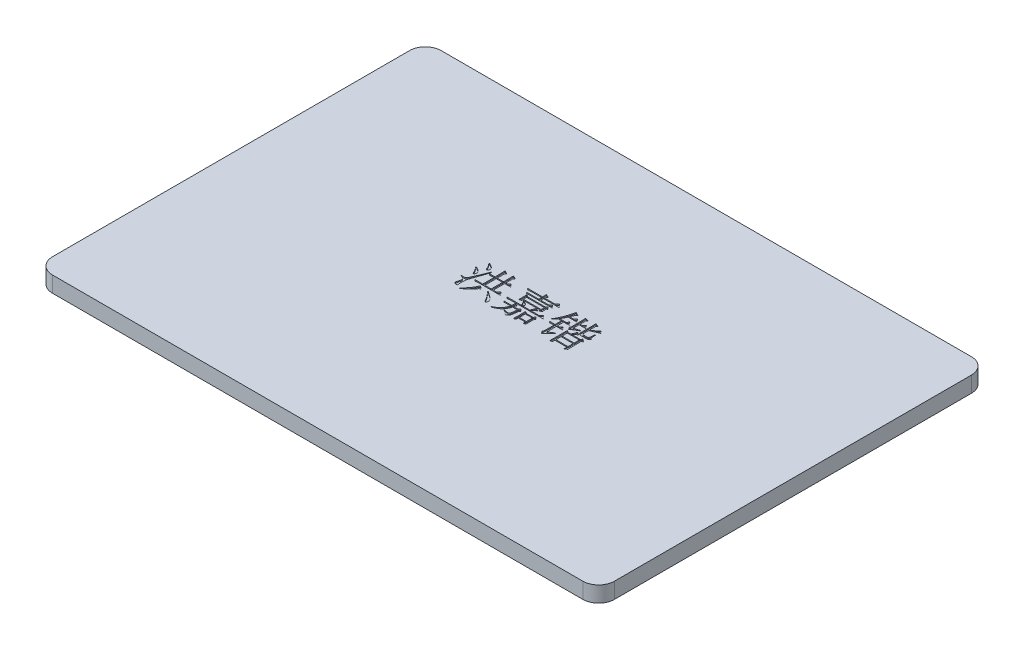
from build123d import *

# Parameters (mm, degrees)
SKETCH_1_W          = 355.22472
SKETCH_1_H          = 245.700000174
EXTRUDE_1_DEPTH     = 10
FILLET_1_R          = 10
SKETCH_5_W          = 4.018359375
SKETCH_5_H          = 7.19717548
SKETCH_5_W_2        = 11.230799279
SKETCH_5_H_2        = 2.068329327
SKETCH_5_W_3        = 4.430498799
SKETCH_5_H_3        = 3.777944711
SKETCH_5_W_4        = 7.624579327
SKETCH_5_H_4        = 3.289483173
CUT_EXTRUDE_2_DEPTH = 0.7


with BuildPart() as part:
    # 草图1 → 凸台-拉伸1 (new body)
    with BuildSketch(Plane(origin=(0, 0, 0), x_dir=(1, 0, 0), z_dir=(0, 1, 0))):
        Rectangle(SKETCH_1_W, SKETCH_1_H)
    extrude(amount=EXTRUDE_1_DEPTH)

    # 圆角1
    fillet_1_edges = [part.edges().sort_by_distance(p)[0] for p in [
        (-177.61236, 5, 122.850000087),
        (-177.61236, 5, -122.850000087),
        (177.61236, 5, -122.850000087),
        (177.61236, 5, 122.850000087),
    ]]
    fillet(fillet_1_edges, radius=FILLET_1_R)

    # 草图5 → 切除-拉伸2 (cut)
    # profile 1 of 15: a face of its own
    with BuildSketch(Plane(origin=(0, 10, 0), x_dir=(1, 0, 0), z_dir=(0, 1, 0))):
        with BuildLine():
            Line((-26.376532916, 6.455864329), (-24.315835801, 4.910341492))
            Line((-24.315835801, 4.910341492), (-25.243149503, 4.498202069))
            add(Edge.make_bspline(
                [(-25.243149503, 4.498202069), (-25.552872326, 4.127666283), (-26.149794207, 3.413540935), (-27.044370975, 2.406984084), (-27.899638569, 1.503294035), (-28.716982063, 0.702583654), (-29.494290751, 0.004558656), (-30.236503903, -0.587768107), (-30.933681629, -1.089794593), (-31.407491806, -1.353330367), (-31.63131056, -1.477819566)],
                knots=[0, 0, 0, 0, 1.317503974, 2.539195995, 3.673307354, 4.711404462, 5.660169823, 6.521932252, 7.301789409, 8, 8, 8, 8], degree=3))
            Line((-31.63131056, -1.477819566), (-31.837380272, -1.168714998))
            add(Edge.make_bspline(
                [(-31.837380272, -1.168714998), (-31.527875157, -0.868874119), (-30.918337529, -0.278369182), (-30.067008552, 0.645493035), (-29.279219378, 1.577579332), (-28.564829928, 2.527366724), (-27.913300318, 3.486491027), (-27.328794133, 4.458550814), (-26.81279952, 5.445977662), (-26.521318333, 6.120709494), (-26.376532916, 6.455864329)],
                knots=[0, 0, 0, 0, 1.094406095, 2.155317194, 3.189574899, 4.19315574, 5.17266735, 6.133525116, 7.072878954, 8, 8, 8, 8], degree=3))
        make_face()
    # profile 2 of 15: a face of its own
    with BuildSketch(Plane(origin=(0, 10, 0), x_dir=(1, 0, 0), z_dir=(0, 1, 0))):
        with BuildLine():
            add(Edge.make_bspline(
                [(-20.812650705, 5.807126348), (-20.60478678, 5.674361816), (-20.199788776, 5.415686001), (-19.618211143, 5.02542716), (-19.072922315, 4.656508634), (-18.566737052, 4.306195178), (-18.105508085, 3.966775152), (-17.686182121, 3.641307221), (-17.302803307, 3.336761719), (-16.959294386, 3.046554697), (-16.650408498, 2.771315947), (-16.379238674, 2.50264444), (-16.138169095, 2.24656537), (-15.936190004, 1.995611048), (-15.760370394, 1.761337327), (-15.627056736, 1.529297251), (-15.521444514, 1.309505004), (-15.433603066, 1.035860457), (-15.376461385, 0.715649962), (-15.375459752, 0.35602173), (-15.451956754, 0.030371522), (-15.599828125, -0.239305416), (-15.761029304, -0.459655331), (-15.916857552, -0.613343493), (-16.042524039, -0.732070349), (-16.136551052, -0.749322408), (-16.176082195, -0.756575575)],
                knots=[0, 0, 0, 0, 1.886732976, 3.676073606, 5.357514201, 6.92318489, 8.384823373, 9.737552754, 10.983710712, 12.129971186, 13.177293715, 14.147504746, 15.049540137, 15.865657004, 16.611132248, 17.287059304, 17.909606159, 18.472736264, 19.480620271, 20.385642455, 21.206963833, 22.007796368, 22.723990221, 23.28137395, 23.697872896, 24, 24, 24, 24], degree=3))
            add(Edge.make_bspline(
                [(-16.176082195, -0.756575575), (-16.212536716, -0.751313744), (-16.29527836, -0.739370846), (-16.414440035, -0.656438112), (-16.538857214, -0.531215914), (-16.675426538, -0.361072944), (-16.825791219, -0.145949737), (-16.978725852, 0.12151421), (-17.142582862, 0.435414974), (-17.251615587, 0.661408545), (-17.309465608, 0.78131505)],
                knots=[0, 0, 0, 0, 0.445326263, 1.010767021, 1.725627242, 2.60973878, 3.671005391, 4.932592747, 6.372510858, 8, 8, 8, 8], degree=3))
            add(Edge.make_bspline(
                [(-17.309465608, 0.78131505), (-17.40137521, 0.956845991), (-17.591893265, 1.320701485), (-17.932138284, 1.860356971), (-18.31734791, 2.42310745), (-18.758275932, 3.001446873), (-19.246958991, 3.602048575), (-19.790427887, 4.21831707), (-20.381560484, 4.857641701), (-20.802359985, 5.280567884), (-21.018720416, 5.498021781)],
                knots=[0, 0, 0, 0, 0.789049163, 1.63560835, 2.539413484, 3.50528574, 4.531787278, 5.623452301, 6.778062039, 8, 8, 8, 8], degree=3))
            Line((-21.018720416, 5.498021781), (-20.812650705, 5.807126348))
        make_face()
    # profile 3 of 15: a face of its own
    with BuildSketch(Plane(origin=(0, 10, 0), x_dir=(1, 0, 0), z_dir=(0, 1, 0))):
        with BuildLine():
            add(Edge.make_bspline(
                [(-26.685637483, 15.992312646), (-26.684847779, 16.38537431), (-26.683339912, 17.135889454), (-26.693526747, 18.208198554), (-26.69965064, 19.174966297), (-26.710344061, 20.036172988), (-26.727441741, 20.791697538), (-26.73909538, 21.44064099), (-26.763369532, 21.98371943), (-26.78084884, 22.310522999), (-26.788672339, 22.456795819)],
                knots=[0, 0, 0, 0, 1.458918773, 2.785671391, 3.980227968, 5.04736289, 5.98239479, 6.78525834, 7.4562982, 8, 8, 8, 8], degree=3))
            Line((-26.788672339, 22.456795819), (-24.624940368, 21.224193656))
            Line((-24.624940368, 21.224193656), (-25.346184358, 20.403730915))
            Line((-25.346184358, 20.403730915), (-25.346184358, 15.992312646))
            Line((-25.346184358, 15.992312646), (-21.327824983, 15.992312646))
            add(Edge.make_bspline(
                [(-21.327824983, 15.992312646), (-21.327031587, 16.377742183), (-21.325518093, 17.112993256), (-21.335745478, 18.164949093), (-21.341819269, 19.113909248), (-21.352557008, 19.961123331), (-21.369642013, 20.705199131), (-21.381342362, 21.346510141), (-21.405531214, 21.884502835), (-21.423033304, 22.208760398), (-21.430859839, 22.353760963)],
                knots=[0, 0, 0, 0, 1.45375198, 2.773198736, 3.967904741, 5.033127203, 5.968906975, 6.775176114, 7.452286776, 8, 8, 8, 8], degree=3))
            Line((-21.430859839, 22.353760963), (-19.164093012, 21.224193656))
            Line((-19.164093012, 21.224193656), (-19.988371858, 20.506765771))
            Line((-19.988371858, 20.506765771), (-19.988371858, 15.992312646))
            Line((-19.988371858, 15.992312646), (-18.854988445, 15.992312646))
            Line((-18.854988445, 15.992312646), (-17.721605031, 17.125696059))
            Line((-17.721605031, 17.125696059), (-16.073047339, 15.374103511))
            Line((-16.073047339, 15.374103511), (-19.988371858, 15.374103511))
            Line((-19.988371858, 15.374103511), (-19.988371858, 8.176928031))
            Line((-19.988371858, 8.176928031), (-17.721605031, 8.176928031))
            Line((-17.721605031, 8.176928031), (-16.485186762, 9.4133463))
            Line((-16.485186762, 9.4133463), (-14.733594214, 7.558718896))
            Line((-14.733594214, 7.558718896), (-28.128125464, 7.558718896))
            add(Edge.make_bspline(
                [(-28.128125464, 7.558718896), (-28.34704105, 7.555144483), (-28.776739834, 7.548128441), (-29.409266558, 7.490207635), (-30.016177577, 7.392312325), (-30.408149418, 7.296664093), (-30.600962003, 7.249614329)],
                knots=[0, 0, 0, 0, 1.051078301, 2.063110603, 3.047236021, 4, 4, 4, 4], degree=3))
            Line((-30.600962003, 7.249614329), (-31.528275705, 8.176928031))
            Line((-31.528275705, 8.176928031), (-26.685637483, 8.176928031))
            Line((-26.685637483, 8.176928031), (-26.685637483, 15.374103511))
            add(Edge.make_bspline(
                [(-26.685637483, 15.374103511), (-26.90455307, 15.370529098), (-27.334251853, 15.363513057), (-27.966778577, 15.30559225), (-28.573689596, 15.207696941), (-28.965661437, 15.112048709), (-29.158474022, 15.064998944)],
                knots=[0, 0, 0, 0, 1.051078301, 2.063110603, 3.047236021, 4, 4, 4, 4], degree=3))
            Line((-29.158474022, 15.064998944), (-30.085787724, 15.992312646))
            Line((-30.085787724, 15.992312646), (-26.685637483, 15.992312646))
        make_face()
        with Locations((-23.337004671, 11.775515771)):
            Rectangle(SKETCH_5_W, SKETCH_5_H, mode=Mode.SUBTRACT)
    # profile 4 of 15: a face of its own
    with BuildSketch(Plane(origin=(0, 10, 0), x_dir=(1, 0, 0), z_dir=(0, 1, 0))):
        with BuildLine():
            add(Edge.make_bspline(
                [(-30.085787724, 17.305053031), (-30.232127131, 16.886572873), (-30.516305113, 16.073921998), (-30.929305673, 14.889954458), (-31.314431326, 13.775106317), (-31.674422701, 12.731153582), (-32.019099956, 11.760677223), (-32.324020439, 10.856480135), (-32.612214224, 10.025687732), (-32.87066156, 9.26421692), (-33.109140606, 8.574573538), (-33.316335756, 7.952478206), (-33.506085653, 7.404738301), (-33.661390811, 6.925213806), (-33.795117281, 6.516947663), (-33.906013489, 6.179067154), (-33.990417535, 5.912056467), (-34.102547294, 5.535322008), (-34.220619051, 4.994409247), (-34.321587319, 4.240218068), (-34.374007345, 3.415268398), (-34.370999509, 2.6929186), (-34.348780773, 2.110579344), (-34.333537468, 1.699707275), (-34.319361557, 1.324350372), (-34.301145825, 0.983323273), (-34.275842139, 0.679642661), (-34.258797226, 0.409631381), (-34.237143441, 0.175291953), (-34.216582611, 0.030753238), (-34.207181955, -0.035331585)],
                knots=[0, 0, 0, 0, 2.065213346, 4.010458801, 5.841337814, 7.559792709, 9.154635155, 10.638776288, 12.004884515, 13.251037834, 14.384762938, 15.404150647, 16.305495703, 17.085031221, 17.752136549, 18.306812302, 18.741612851, 19.05662234, 20.137696071, 21.315966305, 22.598596989, 23.985204075, 24.678912674, 25.31340239, 25.900522496, 26.428738844, 26.904123955, 27.319977756, 27.689085724, 28, 28, 28, 28], degree=3))
            add(Edge.make_bspline(
                [(-34.207181955, -0.035331585), (-34.211074856, -0.097093813), (-34.218462671, -0.214304051), (-34.332442841, -0.359441428), (-34.511150507, -0.436756499), (-34.64646384, -0.443620971), (-34.722356233, -0.447471008)],
                knots=[0, 0, 0, 0, 0.970945968, 1.84262797, 2.790007448, 4, 4, 4, 4], degree=3))
            add(Edge.make_bspline(
                [(-34.722356233, -0.447471008), (-34.795069508, -0.445606274), (-34.95050839, -0.441620041), (-35.194126641, -0.392547456), (-35.466888515, -0.333875407), (-35.752019531, -0.249119684), (-36.026448836, -0.125097463), (-36.231623813, 0.089764763), (-36.354332128, 0.370413975), (-36.365164825, 0.57901847), (-36.370913926, 0.689728511)],
                knots=[0, 0, 0, 0, 0.772266131, 1.650870278, 2.63557594, 3.739727176, 4.816770819, 5.79279391, 6.828597255, 8, 8, 8, 8], degree=3))
            add(Edge.make_bspline(
                [(-36.370913926, 0.689728511), (-36.366358885, 0.786578429), (-36.356170056, 1.003214753), (-36.294362246, 1.357982707), (-36.19149685, 1.775466739), (-36.107303608, 2.073959341), (-36.061809358, 2.235251348)],
                knots=[0, 0, 0, 0, 0.735604743, 1.64541913, 2.727690164, 4, 4, 4, 4], degree=3))
            add(Edge.make_bspline(
                [(-36.061809358, 2.235251348), (-36.01597091, 2.399002692), (-35.929699156, 2.707196283), (-35.828089838, 3.145579594), (-35.766260137, 3.533506734), (-35.756996566, 3.775507269), (-35.752704791, 3.887625146)],
                knots=[0, 0, 0, 0, 1.210130591, 2.27756598, 3.202003226, 4, 4, 4, 4], degree=3))
            add(Edge.make_bspline(
                [(-35.752704791, 3.887625146), (-35.758974025, 4.001235779), (-35.771064257, 4.220334144), (-35.852356911, 4.53369496), (-36.007997515, 4.801696271), (-36.179866662, 4.997090545), (-36.3571883, 5.13112017), (-36.524815554, 5.235011664), (-36.724641374, 5.34039029), (-36.960022908, 5.442812948), (-37.227529941, 5.54554092), (-37.529422941, 5.647950359), (-37.86540127, 5.750990843), (-38.101960334, 5.81543644), (-38.22554133, 5.849103511)],
                knots=[0, 0, 0, 0, 1.186474358, 2.288118494, 3.340491894, 4.393535169, 4.980460936, 5.654619961, 6.450503468, 7.336232545, 8.332409568, 9.440913621, 10.663105798, 12, 12, 12, 12], degree=3))
            Line((-38.22554133, 5.849103511), (-38.22554133, 6.261242934))
            add(Edge.make_bspline(
                [(-38.22554133, 6.261242934), (-38.077955803, 6.246273785), (-37.798020435, 6.217880796), (-37.400407415, 6.172974501), (-37.04523938, 6.143636925), (-36.733590715, 6.120243792), (-36.465200125, 6.104670401), (-36.241167509, 6.095989041), (-36.060623403, 6.09657096), (-35.869743152, 6.100187352), (-35.644939017, 6.181705144), (-35.388659318, 6.373418191), (-35.130974096, 6.668624494), (-34.928103511, 6.946558689), (-34.782612231, 7.200721608), (-34.671564158, 7.4112096), (-34.540918345, 7.690642045), (-34.37860842, 8.033849792), (-34.197186459, 8.447403915), (-33.987880275, 8.927201188), (-33.749616468, 9.474742779), (-33.488963646, 10.089732221), (-33.199585287, 10.771504364), (-32.894537028, 11.523474054), (-32.55262896, 12.338123721), (-32.18968345, 13.22076329), (-31.806507003, 14.172923301), (-31.387021582, 15.188850557), (-30.956308184, 16.278453097), (-30.653711267, 17.024173309), (-30.497927147, 17.408087886)],
                knots=[0, 0, 0, 0, 0.830075272, 1.574459442, 2.238862893, 2.824085871, 3.323147247, 3.743340828, 4.077879155, 4.334516408, 4.807196507, 5.383917005, 6.109308036, 6.992178062, 7.304715133, 7.747282051, 8.323519184, 9.03044616, 9.871676903, 10.850243559, 11.959644673, 13.212970214, 14.587818659, 16.103934593, 17.753630502, 19.53146608, 21.444059407, 23.496787251, 25.681638514, 28, 28, 28, 28], degree=3))
            Line((-30.497927147, 17.408087886), (-30.085787724, 17.305053031))
        make_face()
    # profile 5 of 15: a face of its own
    with BuildSketch(Plane(origin=(0, 10, 0), x_dir=(1, 0, 0), z_dir=(0, 1, 0))):
        with BuildLine():
            add(Edge.make_bspline(
                [(-38.122506474, 15.656495338), (-37.977110702, 15.579601618), (-37.693763431, 15.429751142), (-37.286795171, 15.199507824), (-36.904148206, 14.980641251), (-36.553520022, 14.761321031), (-36.227804572, 14.552101526), (-35.92994071, 14.347628984), (-35.663444927, 14.143776806), (-35.421290307, 13.951125373), (-35.210413112, 13.759208326), (-35.027698238, 13.572501907), (-34.870149645, 13.394468731), (-34.740877874, 13.220408939), (-34.6427087, 13.051186216), (-34.570441221, 12.886426155), (-34.527678965, 12.72669748), (-34.509951261, 12.525011272), (-34.521484013, 12.290059468), (-34.545638101, 12.025813811), (-34.590969903, 11.786969088), (-34.652547623, 11.571945619), (-34.730511642, 11.380697194), (-34.831872915, 11.215179068), (-34.945808057, 11.070873783), (-35.07606544, 10.958449024), (-35.212375494, 10.880887288), (-35.357238459, 10.855441057), (-35.498676356, 10.905587204), (-35.624114597, 11.0163), (-35.742708122, 11.179006761), (-35.856045196, 11.396875478), (-35.964787405, 11.672404492), (-36.027758114, 11.878027564), (-36.061809358, 11.989217694)],
                knots=[0, 0, 0, 0, 1.893095501, 3.689264405, 5.381892658, 6.966521016, 8.448886469, 9.837926004, 11.123486075, 12.310281974, 13.398609199, 14.402931639, 15.31613637, 16.133193937, 16.894143101, 17.563193138, 18.198888481, 18.787480041, 19.886002591, 20.901469769, 21.840485152, 22.679165501, 23.473202729, 24.208942179, 24.906388199, 25.581340091, 26.177351546, 26.695016017, 27.218241395, 27.84253702, 28.5951293, 29.525313441, 30.661819821, 32, 32, 32, 32], degree=3))
            add(Edge.make_bspline(
                [(-36.061809358, 11.989217694), (-36.109782614, 12.106982464), (-36.209929387, 12.352822805), (-36.400120703, 12.722446137), (-36.625568002, 13.112150819), (-36.891613124, 13.520488495), (-37.190554981, 13.952433066), (-37.538636771, 14.396394478), (-37.913931578, 14.868847952), (-38.18732615, 15.181857465), (-38.328576185, 15.343574665)],
                knots=[0, 0, 0, 0, 0.749973478, 1.565610292, 2.450002307, 3.405574224, 4.440389734, 5.548264116, 6.733304116, 8, 8, 8, 8], degree=3))
            Line((-38.328576185, 15.343574665), (-38.122506474, 15.656495338))
        make_face()
    # profile 6 of 15: a face of its own
    with BuildSketch(Plane(origin=(0, 10, 0), x_dir=(1, 0, 0), z_dir=(0, 1, 0))):
        with BuildLine():
            add(Edge.make_bspline(
                [(-35.752704791, 21.632516973), (-35.525823346, 21.517676217), (-35.096324212, 21.300276309), (-34.495715407, 20.978823048), (-33.981570363, 20.671517261), (-33.542772971, 20.39711214), (-33.191544776, 20.138166038), (-32.918717841, 19.905874036), (-32.72312004, 19.694846385), (-32.585077878, 19.443425709), (-32.502590691, 19.166464204), (-32.42083256, 18.885687716), (-32.364136171, 18.655613606), (-32.356062526, 18.51751877), (-32.352554551, 18.457516973)],
                knots=[0, 0, 0, 0, 1.863668053, 3.528026774, 4.990933955, 6.252908641, 7.319419533, 8.185000054, 8.87869082, 9.412923223, 10.270839127, 10.987938654, 11.560262341, 12, 12, 12, 12], degree=3))
            add(Edge.make_bspline(
                [(-32.352554551, 18.457516973), (-32.356753634, 18.374285431), (-32.365105723, 18.208735658), (-32.43906543, 17.969180371), (-32.549393553, 17.737888229), (-32.708397476, 17.53770191), (-32.867723357, 17.361302397), (-33.020791469, 17.236651575), (-33.151814304, 17.147238751), (-33.240833088, 17.132262999), (-33.279868253, 17.125696059)],
                knots=[0, 0, 0, 0, 1.155160721, 2.297645706, 3.461045619, 4.699798524, 5.839126899, 6.756787417, 7.454845311, 8, 8, 8, 8], degree=3))
            add(Edge.make_bspline(
                [(-33.279868253, 17.125696059), (-33.30606104, 17.128763668), (-33.362886944, 17.135418921), (-33.440104539, 17.194220545), (-33.520368962, 17.273145774), (-33.596298298, 17.388715756), (-33.671308211, 17.533678307), (-33.745910082, 17.710872354), (-33.828578334, 17.916599552), (-33.873916964, 18.067825744), (-33.898077387, 18.148412406)],
                knots=[0, 0, 0, 0, 0.500032996, 1.084834029, 1.812926081, 2.676576302, 3.72934377, 4.959066828, 6.379522445, 8, 8, 8, 8], degree=3))
            add(Edge.make_bspline(
                [(-33.898077387, 18.148412406), (-33.945277642, 18.262123666), (-34.043521011, 18.498804112), (-34.219600096, 18.857406716), (-34.431121634, 19.230293653), (-34.671365519, 19.620922627), (-34.947688463, 20.02393792), (-35.252777414, 20.445111463), (-35.594128152, 20.879410029), (-35.834831185, 21.172495969), (-35.958774503, 21.323412406)],
                knots=[0, 0, 0, 0, 0.777293699, 1.617871611, 2.520514027, 3.483466758, 4.512709546, 5.605198666, 6.766863799, 8, 8, 8, 8], degree=3))
            Line((-35.958774503, 21.323412406), (-35.752704791, 21.632516973))
        make_face()
    # profile 7 of 15: a face of its own
    with BuildSketch(Plane(origin=(0, 10, 0), x_dir=(1, 0, 0), z_dir=(0, 1, 0))):
        with BuildLine():
            add(Edge.make_bspline(
                [(7.109535102, 14.428869375), (7.111162508, 14.187166186), (7.114332176, 13.716405394), (7.134115395, 13.031970729), (7.161968278, 12.387901189), (7.196041234, 11.973759212), (7.212569957, 11.772859759)],
                knots=[0, 0, 0, 0, 1.090877612, 2.124681976, 3.090286942, 4, 4, 4, 4], degree=3))
            Line((7.212569957, 11.772859759), (5.770081977, 11.25768548))
            Line((5.770081977, 11.25768548), (5.770081977, 12.081964327))
            Line((5.770081977, 12.081964327), (-5.460717302, 12.081964327))
            Line((-5.460717302, 12.081964327), (-5.460717302, 11.463755192))
            Line((-5.460717302, 11.463755192), (-6.903205283, 11.051615769))
            add(Edge.make_bspline(
                [(-6.903205283, 11.051615769), (-6.874373339, 11.495396767), (-6.817493035, 12.370897861), (-6.791861611, 13.671992919), (-6.816273923, 14.949053405), (-6.874300091, 15.791389128), (-6.903205283, 16.210990769)],
                knots=[0, 0, 0, 0, 1.033226837, 2.038373046, 3.022833929, 4, 4, 4, 4], degree=3))
            Line((-6.903205283, 16.210990769), (-5.254647591, 15.386711923))
            Line((-5.254647591, 15.386711923), (5.667047121, 15.386711923))
            Line((5.667047121, 15.386711923), (6.491325967, 16.210990769))
            Line((6.491325967, 16.210990769), (7.830779092, 14.959308077))
            Line((7.830779092, 14.959308077), (7.109535102, 14.428869375))
        make_face()
        with Locations((0.154682338, 13.734338125)):
            Rectangle(SKETCH_5_W_2, SKETCH_5_H_2, mode=Mode.SUBTRACT)
    # profile 8 of 15: a face of its own
    with BuildSketch(Plane(origin=(0, 10, 0), x_dir=(1, 0, 0), z_dir=(0, 1, 0))):
        with BuildLine():
            add(Edge.make_bspline(
                [(2.369931736, 8.792481153), (2.513366296, 9.090364487), (2.786880022, 9.658394819), (3.142950085, 10.486669379), (3.413570753, 11.254809855), (3.544456921, 11.751627803), (3.606350006, 11.986561682)],
                knots=[0, 0, 0, 0, 1.155902478, 2.204177253, 3.150796372, 4, 4, 4, 4], degree=3))
            Line((3.606350006, 11.986561682), (5.357942554, 10.750143413))
            add(Edge.make_bspline(
                [(5.357942554, 10.750143413), (5.284702153, 10.726540331), (5.124705903, 10.674978563), (4.880003124, 10.547504796), (4.609180297, 10.373897518), (4.31207447, 10.151929976), (3.993017591, 9.878227671), (3.644579449, 9.561089344), (3.272049145, 9.194136668), (3.018041618, 8.930471245), (2.885106015, 8.792481153)],
                knots=[0, 0, 0, 0, 0.579311873, 1.265527301, 2.071670723, 3.003841406, 4.05862736, 5.239813352, 6.555448015, 8, 8, 8, 8], degree=3))
            Line((2.885106015, 8.792481153), (8.139883659, 8.792481153))
            Line((8.139883659, 8.792481153), (9.685406496, 10.33800399))
            Line((9.685406496, 10.33800399), (11.849138467, 8.174272019))
            Line((11.849138467, 8.174272019), (-8.448728119, 8.174272019))
            add(Edge.make_bspline(
                [(-8.448728119, 8.174272019), (-8.667643706, 8.170697606), (-9.097342489, 8.163681564), (-9.729869213, 8.105760758), (-10.336780232, 8.007865448), (-10.728752073, 7.912217216), (-10.921564658, 7.865167452)],
                knots=[0, 0, 0, 0, 1.051078301, 2.063110603, 3.047236021, 4, 4, 4, 4], degree=3))
            Line((-10.921564658, 7.865167452), (-11.84887836, 8.792481153))
            Line((-11.84887836, 8.792481153), (-3.090915619, 8.792481153))
            add(Edge.make_bspline(
                [(-3.090915619, 8.792481153), (-3.110286987, 8.92012253), (-3.14878817, 9.173813642), (-3.246518291, 9.546278667), (-3.373198746, 9.909236494), (-3.525904799, 10.263855991), (-3.704376196, 10.610785292), (-3.921813311, 10.941467536), (-4.160059422, 11.267373768), (-4.339701368, 11.471431801), (-4.430368744, 11.574422259)],
                knots=[0, 0, 0, 0, 0.987169243, 1.962028859, 2.940766986, 3.926015477, 4.914143695, 5.921071579, 6.950740687, 8, 8, 8, 8], degree=3))
            Line((-4.430368744, 11.574422259), (-4.121264177, 11.780491971))
            add(Edge.make_bspline(
                [(-4.121264177, 11.780491971), (-3.989943152, 11.722650946), (-3.739902632, 11.612519306), (-3.388314759, 11.445180695), (-3.077569343, 11.282884417), (-2.804071673, 11.134275106), (-2.572792662, 10.987808781), (-2.382996555, 10.851592147), (-2.228263042, 10.72648107), (-2.090365753, 10.568884721), (-1.959761304, 10.396986274), (-1.849164647, 10.211854325), (-1.771243254, 10.06131919), (-1.757298958, 9.965831485), (-1.751462494, 9.925864567)],
                knots=[0, 0, 0, 0, 1.657238538, 3.155448906, 4.495891593, 5.705929702, 6.749312488, 7.654459726, 8.405004114, 9.039451404, 10.067832698, 10.891717428, 11.536122073, 12, 12, 12, 12], degree=3))
            add(Edge.make_bspline(
                [(-1.751462494, 9.925864567), (-1.763232406, 9.849054565), (-1.79063873, 9.670201918), (-1.973417069, 9.408542524), (-2.22703223, 9.10068707), (-2.451273717, 8.902491637), (-2.575741341, 8.792481153)],
                knots=[0, 0, 0, 0, 0.644077925, 1.499740116, 2.612204154, 4, 4, 4, 4], degree=3))
            Line((-2.575741341, 8.792481153), (2.369931736, 8.792481153))
        make_face()
    # profile 9 of 15: a face of its own
    with BuildSketch(Plane(origin=(0, 10, 0), x_dir=(1, 0, 0), z_dir=(0, 1, 0))):
        with BuildLine():
            Line((-3.709124754, 6.956934278), (-4.430368744, 6.44176))
            Line((-4.430368744, 6.44176), (-4.5334036, 5.617481153))
            Line((-4.5334036, 5.617481153), (-1.751462494, 5.617481153))
            Line((-1.751462494, 5.617481153), (-0.927183648, 6.544794855))
            Line((-0.927183648, 6.544794855), (0.412269477, 5.308376586))
            Line((0.412269477, 5.308376586), (-0.308974514, 4.686351346))
            add(Edge.make_bspline(
                [(-0.308974514, 4.686351346), (-0.333919518, 4.365633183), (-0.381283917, 3.756668662), (-0.475676565, 2.894609142), (-0.566802744, 2.130270133), (-0.673422625, 1.465925056), (-0.786300346, 0.898953141), (-0.904762625, 0.430084684), (-1.031204552, 0.057820259), (-1.213137083, -0.309558084), (-1.516248995, -0.671469347), (-1.951056178, -1.044478216), (-2.480572871, -1.376770214), (-2.880714147, -1.544833247), (-3.090915619, -1.633119808)],
                knots=[0, 0, 0, 0, 1.559433163, 2.960978146, 4.203946745, 5.290783196, 6.222038986, 7.005811568, 7.633862297, 8.12477619, 8.984825344, 9.898539616, 10.896064733, 12, 12, 12, 12], degree=3))
            add(Edge.make_bspline(
                [(-3.090915619, -1.633119808), (-3.106985506, -1.537739556), (-3.13986654, -1.342579415), (-3.275446986, -1.061840928), (-3.472244687, -0.788839131), (-3.74326738, -0.530123753), (-4.074686681, -0.273771879), (-4.4727642, -0.022383472), (-4.942192261, 0.216473541), (-5.28171534, 0.36219759), (-5.460717302, 0.439025625)],
                knots=[0, 0, 0, 0, 0.702791048, 1.437999979, 2.249477787, 3.148748125, 4.160729975, 5.30412039, 6.578689427, 8, 8, 8, 8], degree=3))
            Line((-5.460717302, 0.439025625), (-5.357682446, 0.854981153))
            add(Edge.make_bspline(
                [(-5.357682446, 0.854981153), (-5.217739723, 0.8220027), (-4.951961542, 0.759370268), (-4.572590398, 0.668440068), (-4.230346477, 0.599482994), (-3.928328108, 0.532468243), (-3.664955538, 0.47920443), (-3.439872759, 0.436650012), (-3.252829338, 0.406021702), (-3.05887771, 0.378717476), (-2.846364554, 0.375362949), (-2.611613748, 0.429330157), (-2.400337273, 0.539209279), (-2.223337708, 0.670616016), (-2.102075564, 0.871056472), (-2.025287592, 1.136631532), (-1.944353166, 1.508294955), (-1.854654995, 1.990074431), (-1.781320881, 2.585843944), (-1.694433317, 3.291235707), (-1.616136101, 4.108257578), (-1.569940185, 4.690096673), (-1.545392783, 4.999272019)],
                knots=[0, 0, 0, 0, 1.127304843, 2.14096898, 3.0583606, 3.864296518, 4.566484481, 5.165055624, 5.660223409, 6.052370201, 6.700642221, 7.315121189, 7.917254547, 8.562142115, 9.0103914, 9.726327056, 10.718318498, 11.995733577, 13.565620174, 15.423702583, 17.568265267, 20, 20, 20, 20], degree=3))
            Line((-1.545392783, 4.999272019), (-4.636438456, 4.999272019))
            add(Edge.make_bspline(
                [(-4.636438456, 4.999272019), (-4.69886817, 4.772116256), (-4.820474467, 4.329641525), (-5.039759314, 3.692559789), (-5.282891965, 3.096850082), (-5.552137328, 2.542097015), (-5.853062956, 2.032996095), (-6.170588932, 1.561105629), (-6.521526906, 1.135259356), (-6.899809927, 0.743803617), (-7.318991447, 0.382629678), (-7.779654446, 0.034234189), (-8.287073987, -0.304173143), (-8.842243558, -0.633204119), (-9.447290726, -0.948847381), (-10.100682591, -1.257311068), (-10.801416439, -1.559349094), (-11.289698649, -1.744410028), (-11.539773793, -1.83918952)],
                knots=[0, 0, 0, 0, 1.105987961, 2.154344309, 3.161512562, 4.125864412, 5.046823458, 5.9364916, 6.793831457, 7.634424412, 8.489639301, 9.389197822, 10.345077244, 11.352050647, 12.41809063, 13.548281948, 14.744345518, 16, 16, 16, 16], degree=3))
            Line((-11.539773793, -1.83918952), (-11.745843504, -1.530084952))
            add(Edge.make_bspline(
                [(-11.745843504, -1.530084952), (-11.513563871, -1.40940391), (-11.061877764, -1.174730085), (-10.416495808, -0.809108956), (-9.821781886, -0.439269223), (-9.282961465, -0.06148768), (-8.789116807, 0.312303744), (-8.350044545, 0.692990736), (-7.963627698, 1.079252301), (-7.623602428, 1.468536131), (-7.323399172, 1.866435718), (-7.051465533, 2.275251078), (-6.808717062, 2.698172077), (-6.589562062, 3.132537344), (-6.393904325, 3.579002703), (-6.227172948, 4.04082014), (-6.084118951, 4.514467707), (-6.01206835, 4.837218248), (-5.975891581, 4.999272019)],
                knots=[0, 0, 0, 0, 1.386177337, 2.695531401, 3.927323847, 5.093463353, 6.179463281, 7.206110486, 8.16834236, 9.070775631, 9.94115896, 10.806233829, 11.669391762, 12.521996049, 13.381808856, 14.249162757, 15.120900688, 16, 16, 16, 16], degree=3))
            Line((-5.975891581, 4.999272019), (-9.066937254, 4.999272019))
            Line((-9.066937254, 4.999272019), (-9.994250956, 4.793202307))
            Line((-9.994250956, 4.793202307), (-10.818529802, 5.617481153))
            Line((-10.818529802, 5.617481153), (-5.872856725, 5.617481153))
            add(Edge.make_bspline(
                [(-5.872856725, 5.617481153), (-5.856067757, 5.757271839), (-5.818002383, 6.074217154), (-5.793581759, 6.609467851), (-5.77377476, 7.259515213), (-5.771210751, 7.731575411), (-5.769821869, 7.987282836)],
                knots=[0, 0, 0, 0, 0.711633008, 1.613474798, 2.707257642, 4, 4, 4, 4], degree=3))
            Line((-5.769821869, 7.987282836), (-3.709124754, 6.956934278))
        make_face()
    # profile 10 of 15: a face of its own
    with BuildSketch(Plane(origin=(0, 10, 0), x_dir=(1, 0, 0), z_dir=(0, 1, 0))):
        with BuildLine():
            add(Edge.make_bspline(
                [(8.86112765, 4.88097274), (8.86034493, 4.585856936), (8.858846934, 4.021054346), (8.868989253, 3.214605567), (8.875165975, 2.48697432), (8.885771209, 1.840726807), (8.902989374, 1.273487314), (8.914613914, 0.786025875), (8.938755052, 0.377800416), (8.95632824, 0.132449473), (8.964162506, 0.023070096)],
                knots=[0, 0, 0, 0, 1.457354977, 2.789135164, 3.982724758, 5.050780449, 5.980811906, 6.785262335, 7.458460407, 8, 8, 8, 8], degree=3))
            Line((8.964162506, 0.023070096), (7.624709381, -0.698173895))
            Line((7.624709381, -0.698173895), (7.624709381, 0.847348942))
            Line((7.624709381, 0.847348942), (3.194210582, 0.847348942))
            Line((3.194210582, 0.847348942), (3.194210582, -0.492104183))
            Line((3.194210582, -0.492104183), (1.854757457, -1.110313318))
            add(Edge.make_bspline(
                [(1.854757457, -1.110313318), (1.883704649, -0.483312862), (1.942340767, 0.786754157), (1.965725812, 2.708341775), (1.941775712, 4.646422215), (1.883674976, 5.939415664), (1.854757457, 6.582955913)],
                knots=[0, 0, 0, 0, 0.97854381, 1.982161591, 2.995694656, 4, 4, 4, 4], degree=3))
            Line((1.854757457, 6.582955913), (3.297245438, 5.861711923))
            Line((3.297245438, 5.861711923), (7.418639669, 5.861711923))
            Line((7.418639669, 5.861711923), (8.242918515, 6.789025625))
            Line((8.242918515, 6.789025625), (9.685406496, 5.533526827))
            Line((9.685406496, 5.533526827), (8.86112765, 4.88097274))
        make_face()
        with Locations((5.409459982, 3.354530433)):
            Rectangle(SKETCH_5_W_3, SKETCH_5_H_3, mode=Mode.SUBTRACT)
    # profile 11 of 15: a face of its own
    with BuildSketch(Plane(origin=(0, 10, 0), x_dir=(1, 0, 0), z_dir=(0, 1, 0))):
        with BuildLine():
            add(Edge.make_bspline(
                [(-0.721113937, 20.027096538), (-0.722896112, 20.221733472), (-0.726566034, 20.622537092), (-0.747272693, 21.24333041), (-0.775997477, 21.90122793), (-0.807823565, 22.352438465), (-0.824148793, 22.583887403)],
                knots=[0, 0, 0, 0, 0.91259792, 1.879255615, 2.912161842, 4, 4, 4, 4], degree=3))
            Line((-0.824148793, 22.583887403), (1.442618034, 21.561171057))
            Line((1.442618034, 21.561171057), (0.618339188, 20.843743173))
            Line((0.618339188, 20.843743173), (0.618339188, 20.027096538))
            Line((0.618339188, 20.027096538), (7.212569957, 20.027096538))
            Line((7.212569957, 20.027096538), (8.552023082, 21.366549663))
            Line((8.552023082, 21.366549663), (10.509685342, 19.408887403))
            Line((10.509685342, 19.408887403), (0.618339188, 19.408887403))
            Line((0.618339188, 19.408887403), (0.618339188, 17.584788846))
            Line((0.618339188, 17.584788846), (5.873116832, 17.584788846))
            Line((5.873116832, 17.584788846), (7.006500246, 18.718172259))
            Line((7.006500246, 18.718172259), (8.758092794, 16.966579711))
            Line((8.758092794, 16.966579711), (-4.945543023, 16.966579711))
            add(Edge.make_bspline(
                [(-4.945543023, 16.966579711), (-5.16445861, 16.963005298), (-5.594157393, 16.955989257), (-6.226684117, 16.89806845), (-6.833595136, 16.80017314), (-7.225566977, 16.704524908), (-7.418379562, 16.657475144)],
                knots=[0, 0, 0, 0, 1.051078301, 2.063110603, 3.047236021, 4, 4, 4, 4], degree=3))
            Line((-7.418379562, 16.657475144), (-8.345693264, 17.584788846))
            Line((-8.345693264, 17.584788846), (-0.721113937, 17.584788846))
            Line((-0.721113937, 17.584788846), (-0.721113937, 19.408887403))
            Line((-0.721113937, 19.408887403), (-6.800170427, 19.408887403))
            add(Edge.make_bspline(
                [(-6.800170427, 19.408887403), (-7.019086013, 19.405312991), (-7.448784797, 19.398296949), (-8.081311521, 19.340376142), (-8.68822254, 19.242480833), (-9.080194381, 19.146832601), (-9.273006966, 19.099782836)],
                knots=[0, 0, 0, 0, 1.051078301, 2.063110603, 3.047236021, 4, 4, 4, 4], degree=3))
            Line((-9.273006966, 19.099782836), (-10.200320668, 20.027096538))
            Line((-10.200320668, 20.027096538), (-0.721113937, 20.027096538))
        make_face()
    # profile 12 of 15: a face of its own
    with BuildSketch(Plane(origin=(0, 10, 0), x_dir=(1, 0, 0), z_dir=(0, 1, 0))):
        with BuildLine():
            Line((24.728235331, 13.563773459), (24.728235331, 18.204158074))
            add(Edge.make_bspline(
                [(24.728235331, 18.204158074), (24.726377943, 18.476383298), (24.722454496, 19.051417257), (24.701734314, 19.959672389), (24.672638461, 20.958361866), (24.641452414, 21.65395456), (24.625200475, 22.016447738)],
                knots=[0, 0, 0, 0, 0.85652004, 1.809266984, 2.858346587, 4, 4, 4, 4], degree=3))
            Line((24.625200475, 22.016447738), (26.891967302, 21.192168892))
            Line((26.891967302, 21.192168892), (26.067688456, 20.474741007))
            Line((26.067688456, 20.474741007), (26.067688456, 16.979188123))
            Line((26.067688456, 16.979188123), (27.613211293, 16.979188123))
            Line((27.613211293, 16.979188123), (28.849629562, 18.112571536))
            Line((28.849629562, 18.112571536), (30.292117543, 16.360978988))
            Line((30.292117543, 16.360978988), (26.067688456, 16.360978988))
            Line((26.067688456, 16.360978988), (26.067688456, 12.537241007))
            Line((26.067688456, 12.537241007), (29.673908408, 13.674440526))
            Line((29.673908408, 13.674440526), (29.879978119, 13.262301103))
            add(Edge.make_bspline(
                [(29.879978119, 13.262301103), (29.60047939, 13.13579745), (29.063905347, 12.892939183), (28.306411021, 12.512067259), (27.632021763, 12.131557861), (27.035465177, 11.757205874), (26.518821681, 11.386728797), (26.085485552, 11.013653125), (25.721915209, 10.65275753), (25.536603604, 10.390131668), (25.449479321, 10.266658074)],
                knots=[0, 0, 0, 0, 1.360927464, 2.612671462, 3.759881031, 4.794718843, 5.736096991, 6.576478527, 7.330731139, 8, 8, 8, 8], degree=3))
            Line((25.449479321, 10.266658074), (24.316095908, 11.812180911))
            add(Edge.make_bspline(
                [(24.316095908, 11.812180911), (24.35692258, 11.858146082), (24.439528531, 11.951148927), (24.540766519, 12.115803133), (24.617232905, 12.303764735), (24.687066636, 12.511515985), (24.719000442, 12.745105558), (24.743919199, 12.998345434), (24.746876672, 13.274040267), (24.734615082, 13.464616132), (24.728235331, 13.563773459)],
                knots=[0, 0, 0, 0, 0.794920111, 1.608388042, 2.486313334, 3.418621612, 4.436589417, 5.527971172, 6.713794266, 8, 8, 8, 8], degree=3))
        make_face()
    # profile 13 of 15: a face of its own
    with BuildSketch(Plane(origin=(0, 10, 0), x_dir=(1, 0, 0), z_dir=(0, 1, 0))):
        with BuildLine():
            Line((30.910326677, 12.739494613), (30.910326677, 19.131471776))
            add(Edge.make_bspline(
                [(30.910326677, 19.131471776), (30.905547548, 19.646783524), (30.89598418, 20.677957922), (30.836866469, 21.707480933), (30.807291821, 22.222517449)],
                knots=[0, 0, 0, 0, 0.999465752, 2, 2, 2, 2], degree=3))
            Line((30.807291821, 22.222517449), (33.177093504, 21.295203748))
            Line((33.177093504, 21.295203748), (32.249779802, 20.573959757))
            Line((32.249779802, 20.573959757), (32.249779802, 16.654819132))
            add(Edge.make_bspline(
                [(32.249779802, 16.654819132), (32.49764511, 16.80575064), (32.976056046, 17.097067262), (33.650563995, 17.546221942), (34.267082843, 17.972987889), (34.812630315, 18.395906434), (35.300376965, 18.79628614), (35.717449025, 19.192333744), (36.076267704, 19.570062203), (36.276510661, 19.83194668), (36.371174033, 19.955750623)],
                knots=[0, 0, 0, 0, 1.311194889, 2.530769553, 3.661384337, 4.698397145, 5.649249358, 6.51125483, 7.296206775, 8, 8, 8, 8], degree=3))
            Line((36.371174033, 19.955750623), (37.916696869, 18.410227786))
            add(Edge.make_bspline(
                [(37.916696869, 18.410227786), (37.731517978, 18.372531236), (37.366446942, 18.298214349), (36.83669973, 18.135661793), (36.332429086, 17.934952453), (36.013787481, 17.770445689), (35.855999754, 17.688983796)],
                knots=[0, 0, 0, 0, 1.033843064, 2.038170529, 3.028524187, 4, 4, 4, 4], degree=3))
            add(Edge.make_bspline(
                [(35.855999754, 17.688983796), (35.76202017, 17.642877302), (35.5597228, 17.543629976), (35.230318255, 17.39070048), (34.851416124, 17.223955715), (34.424967701, 17.036005046), (33.948513409, 16.8353657), (33.42493003, 16.616620933), (32.852496994, 16.385703153), (32.455788614, 16.223747611), (32.249779802, 16.139644853)],
                knots=[0, 0, 0, 0, 0.639944871, 1.377524327, 2.220010226, 3.17068517, 4.226514883, 5.380427766, 6.639668354, 8, 8, 8, 8], degree=3))
            Line((32.249779802, 16.139644853), (32.249779802, 13.460738603))
            add(Edge.make_bspline(
                [(32.249779802, 13.460738603), (32.245743339, 13.348804447), (32.238196708, 13.139530698), (32.268293093, 12.845720223), (32.347466054, 12.598499238), (32.471586472, 12.400202544), (32.640552802, 12.250486142), (32.853021791, 12.155552961), (33.10660188, 12.11065378), (33.286354455, 12.117563911), (33.383163216, 12.121285478)],
                knots=[0, 0, 0, 0, 1.287332353, 2.406815565, 3.378218178, 4.246574405, 5.065341104, 5.935789313, 6.888284745, 8, 8, 8, 8], degree=3))
            Line((33.383163216, 12.121285478), (35.340825475, 12.121285478))
            add(Edge.make_bspline(
                [(35.340825475, 12.121285478), (35.405972459, 12.124006111), (35.531660037, 12.129255007), (35.709866615, 12.175298181), (35.866879704, 12.253669602), (36.003348141, 12.362007558), (36.114920373, 12.504278556), (36.207385444, 12.674169774), (36.274686915, 12.876016648), (36.339224981, 13.196603549), (36.399313194, 13.656980901), (36.468109727, 14.272766365), (36.528615445, 14.972642272), (36.560440635, 15.466668671), (36.577243744, 15.72750543)],
                knots=[0, 0, 0, 0, 0.561332905, 1.082975276, 1.573695139, 2.065517883, 2.572766535, 3.122723185, 3.726528005, 4.400173963, 5.94110466, 7.729642246, 9.74533046, 12, 12, 12, 12], degree=3))
            Line((36.577243744, 15.72750543), (36.989383168, 15.72750543))
            add(Edge.make_bspline(
                [(36.989383168, 15.72750543), (36.998286074, 15.587583818), (37.015447116, 15.317874064), (37.040088671, 14.930898251), (37.072612965, 14.577521693), (37.10095591, 14.257863264), (37.136160832, 13.971820615), (37.170691534, 13.718714865), (37.203144278, 13.499247432), (37.251710919, 13.254364016), (37.349975515, 12.974759816), (37.567760846, 12.685384358), (37.859568426, 12.42327652), (38.099070473, 12.293166965), (38.225801437, 12.224320334)],
                knots=[0, 0, 0, 0, 1.279589915, 2.46650874, 3.538581197, 4.518162617, 5.395095643, 6.168390741, 6.8497798, 7.418983578, 8.447557173, 9.520446447, 10.687960232, 12, 12, 12, 12], degree=3))
            add(Edge.make_bspline(
                [(38.225801437, 12.224320334), (38.170575893, 12.12547391), (38.06113827, 11.929595028), (37.839351637, 11.67469885), (37.573708833, 11.463084462), (37.270296446, 11.284704697), (36.921926131, 11.154808309), (36.536454615, 11.052987579), (36.106879696, 10.998159044), (35.806530071, 10.991417208), (35.649930043, 10.987902065)],
                knots=[0, 0, 0, 0, 0.898578123, 1.780666118, 2.665302167, 3.589973734, 4.566731163, 5.611852189, 6.754837755, 8, 8, 8, 8], degree=3))
            Line((35.649930043, 10.987902065), (32.661919225, 10.987902065))
            add(Edge.make_bspline(
                [(32.661919225, 10.987902065), (32.523999314, 10.991861786), (32.26429277, 10.999318037), (31.902144065, 11.084953395), (31.592831748, 11.220728109), (31.340085649, 11.417661036), (31.143152722, 11.670407136), (31.007378008, 11.979719453), (30.921742649, 12.341868158), (30.914286398, 12.601574702), (30.910326677, 12.739494613)],
                knots=[0, 0, 0, 0, 1.164274731, 2.192357615, 3.126301231, 4, 4.873698769, 5.807642385, 6.835725269, 8, 8, 8, 8], degree=3))
        make_face()
    # profile 14 of 15: a face of its own
    with BuildSketch(Plane(origin=(0, 10, 0), x_dir=(1, 0, 0), z_dir=(0, 1, 0))):
        with BuildLine():
            add(Edge.make_bspline(
                [(25.449479321, -1.712097935), (25.466008637, -1.299998869), (25.500182251, -0.448002694), (25.528020234, 0.873852424), (25.54703476, 2.279487456), (25.555364699, 3.747477945), (25.546822191, 5.23454363), (25.527736693, 6.697416973), (25.499429592, 8.114634712), (25.465947768, 9.042995274), (25.449479321, 9.499620815)],
                knots=[0, 0, 0, 0, 0.882634023, 1.824805913, 2.829431466, 3.891147328, 4.966474577, 6.011931217, 7.022143961, 8, 8, 8, 8], degree=3))
            Line((25.449479321, 9.499620815), (26.891967302, 8.675341969))
            Line((26.891967302, 8.675341969), (28.540524994, 8.675341969))
            add(Edge.make_bspline(
                [(28.540524994, 8.675341969), (28.671868823, 8.931654565), (28.929747833, 9.434895864), (29.240636146, 10.212623072), (29.497944992, 10.985165121), (29.615776129, 11.50829851), (29.673908408, 11.766387642)],
                knots=[0, 0, 0, 0, 1.045695835, 2.053107559, 3.039495872, 4, 4, 4, 4], degree=3))
            Line((29.673908408, 11.766387642), (31.528535812, 10.633004228))
            add(Edge.make_bspline(
                [(31.528535812, 10.633004228), (31.309475999, 10.506312015), (30.869116734, 10.251632304), (30.257010883, 9.788853134), (29.676314928, 9.269184767), (29.3328366, 8.875097251), (29.158734129, 8.675341969)],
                knots=[0, 0, 0, 0, 0.981368808, 1.972771008, 2.972437128, 4, 4, 4, 4], degree=3))
            Line((29.158734129, 8.675341969), (34.413511773, 8.675341969))
            Line((34.413511773, 8.675341969), (35.237790619, 9.705690526))
            Line((35.237790619, 9.705690526), (36.783313456, 8.362421296))
            Line((36.783313456, 8.362421296), (35.855999754, 7.637361199))
            add(Edge.make_bspline(
                [(35.855999754, 7.637361199), (35.856103941, 7.366417954), (35.856307423, 6.837251804), (35.854859943, 6.062575365), (35.859949095, 5.327345107), (35.863504764, 4.630269474), (35.867247775, 3.971353908), (35.871484159, 3.349333119), (35.873786859, 2.765439968), (35.88268418, 2.219761398), (35.889977075, 1.71348792), (35.89760166, 1.245376577), (35.905612642, 0.815438921), (35.911680169, 0.422304712), (35.924155645, 0.068730745), (35.935492548, -0.246737088), (35.946639216, -0.524059469), (35.955110024, -0.697018756), (35.95903461, -0.777152022)],
                knots=[0, 0, 0, 0, 1.54534462, 3.01813785, 4.418398485, 5.738853726, 6.994013753, 8.176623675, 9.286683661, 10.324270012, 11.289312601, 12.174558496, 12.994517609, 13.741937796, 14.417016693, 15.012336111, 15.542408308, 16, 16, 16, 16], degree=3))
            Line((35.95903461, -0.777152022), (34.516546629, -1.506028224))
            Line((34.516546629, -1.506028224), (34.516546629, 0.241748219))
            Line((34.516546629, 0.241748219), (26.891967302, 0.241748219))
            Line((26.891967302, 0.241748219), (26.891967302, -1.170210916))
            Line((26.891967302, -1.170210916), (25.449479321, -1.712097935))
        make_face()
        with Locations((30.704256966, 6.412391248)):
            Rectangle(SKETCH_5_W_4, SKETCH_5_H_4, mode=Mode.SUBTRACT)
        with Locations((30.704256966, 2.50469894)):
            Rectangle(SKETCH_5_W_4, SKETCH_5_H_4, mode=Mode.SUBTRACT)
    # profile 15 of 15: a face of its own
    with BuildSketch(Plane(origin=(0, 10, 0), x_dir=(1, 0, 0), z_dir=(0, 1, 0))):
        with BuildLine():
            Line((19.782562254, 2.348238603), (23.182712494, 4.332613603))
            Line((23.182712494, 4.332613603), (23.491817062, 4.01969293))
            add(Edge.make_bspline(
                [(23.491817062, 4.01969293), (23.196823461, 3.767879483), (22.633945657, 3.287393803), (21.847456025, 2.580025671), (21.151690682, 1.929663521), (20.549754663, 1.330108483), (20.040975593, 0.781860233), (19.623829112, 0.287028967), (19.292850475, -0.15287067), (19.133524084, -0.445910518), (19.061318264, -0.578714522)],
                knots=[0, 0, 0, 0, 1.450913733, 2.768491027, 3.956881949, 5.013464689, 5.946280289, 6.753593021, 7.4351354, 8, 8, 8, 8], degree=3))
            Line((19.061318264, -0.578714522), (17.92793485, 1.092739805))
            add(Edge.make_bspline(
                [(17.92793485, 1.092739805), (17.992001437, 1.188453738), (18.127058315, 1.390225451), (18.251697096, 1.760284916), (18.326131062, 2.189935592), (18.335245481, 2.497965789), (18.340074273, 2.661159276)],
                knots=[0, 0, 0, 0, 0.835027112, 1.760295973, 2.813411427, 4, 4, 4, 4], degree=3))
            Line((18.340074273, 2.661159276), (18.340074273, 8.301363603))
            Line((18.340074273, 8.301363603), (17.824899994, 8.301363603))
            add(Edge.make_bspline(
                [(17.824899994, 8.301363603), (17.650493017, 8.29751323), (17.296959127, 8.28970828), (16.761112164, 8.23070152), (16.213668309, 8.130021617), (15.847706937, 8.038771378), (15.661168023, 7.992259036)],
                knots=[0, 0, 0, 0, 0.954763695, 1.935365939, 2.947608617, 4, 4, 4, 4], degree=3))
            Line((15.661168023, 7.992259036), (14.733854321, 8.919572738))
            Line((14.733854321, 8.919572738), (18.340074273, 8.919572738))
            Line((18.340074273, 8.919572738), (18.340074273, 12.941748219))
            Line((18.340074273, 12.941748219), (16.279377158, 12.941748219))
            add(Edge.make_bspline(
                [(16.279377158, 12.941748219), (16.152025076, 12.779280901), (15.88489009, 12.438487851), (15.441453558, 11.921608336), (14.955118723, 11.358847269), (14.60633526, 10.97687874), (14.424749754, 10.778016248)],
                knots=[0, 0, 0, 0, 0.868915792, 1.822646346, 2.866414531, 4, 4, 4, 4], degree=3))
            Line((14.424749754, 10.778016248), (14.115645187, 10.984085959))
            add(Edge.make_bspline(
                [(14.115645187, 10.984085959), (14.345496695, 11.341257446), (14.816003309, 12.072388376), (15.44744986, 13.248860375), (16.047430974, 14.509603541), (16.606644952, 15.85922143), (17.13105526, 17.295974365), (17.60674653, 18.824828032), (18.057835743, 20.438299957), (18.31283363, 21.551011178), (18.443109129, 22.119482594)],
                knots=[0, 0, 0, 0, 0.848276614, 1.736424359, 2.665134388, 3.636897109, 4.653886698, 5.719655751, 6.834998247, 8, 8, 8, 8], degree=3))
            Line((18.443109129, 22.119482594), (20.709875956, 20.993731392))
            add(Edge.make_bspline(
                [(20.709875956, 20.993731392), (20.578482187, 20.904595496), (20.318089688, 20.727948469), (19.980429559, 20.398506613), (19.694520241, 20.025007215), (19.385790778, 19.456530095), (19.049168194, 18.678698538), (18.785629973, 18.041697772), (18.649178841, 17.71188043)],
                knots=[0, 0, 0, 0, 0.722444647, 1.431720613, 2.139003694, 2.858067783, 4.37321431, 6, 6, 6, 6], degree=3))
            Line((18.649178841, 17.71188043), (21.122015379, 17.71188043))
            Line((21.122015379, 17.71188043), (22.461468504, 18.948298699))
            Line((22.461468504, 18.948298699), (24.006991341, 17.093671296))
            Line((24.006991341, 17.093671296), (18.443109129, 17.093671296))
            add(Edge.make_bspline(
                [(18.443109129, 17.093671296), (18.291633948, 16.764298203), (17.997048374, 16.123740717), (17.527222225, 15.209583513), (17.0711792, 14.354661942), (16.746044042, 13.819365166), (16.588481725, 13.559957353)],
                knots=[0, 0, 0, 0, 1.089250923, 2.118351038, 3.088142387, 4, 4, 4, 4], degree=3))
            Line((16.588481725, 13.559957353), (20.6068411, 13.559957353))
            Line((20.6068411, 13.559957353), (21.740224514, 14.796375623))
            Line((21.740224514, 14.796375623), (23.388782206, 12.941748219))
            Line((23.388782206, 12.941748219), (19.782562254, 12.941748219))
            Line((19.782562254, 12.941748219), (19.782562254, 8.919572738))
            Line((19.782562254, 8.919572738), (21.122015379, 8.919572738))
            Line((21.122015379, 8.919572738), (22.255398793, 10.155991007))
            Line((22.255398793, 10.155991007), (23.800921629, 8.301363603))
            Line((23.800921629, 8.301363603), (19.782562254, 8.301363603))
            Line((19.782562254, 8.301363603), (19.782562254, 2.348238603))
        make_face()
    extrude(amount=-CUT_EXTRUDE_2_DEPTH, mode=Mode.SUBTRACT)


solid = part.part
